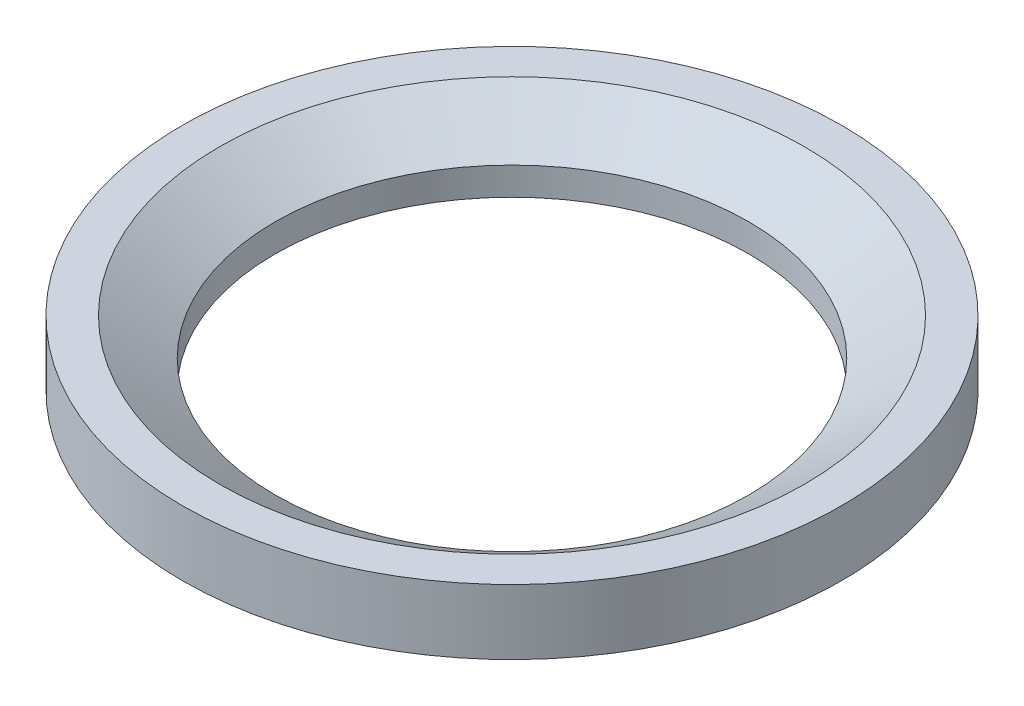
from build123d import *

# Parameters (mm, degrees)
SKETCH1_R           = 35.5
SKETCH1_R_2         = 25.5
BOSS_EXTRUDE1_DEPTH = 7
CHAMFER1_SIZE       = 6
CHAMFER1_SIZE2      = 4


with BuildPart() as part:
    # Sketch1 → Boss-Extrude1 (new body)
    with BuildSketch(Plane(origin=(0, 0, 0), x_dir=(1, 0, 0), z_dir=(0, 1, 0))):
        with Locations(Location((0, 0, 0), (0, 0, 270))):
            Circle(SKETCH1_R)
        with Locations(Location((0, 0, 0), (0, 0, 270))):
            Circle(SKETCH1_R_2, mode=Mode.SUBTRACT)
    extrude(amount=BOSS_EXTRUDE1_DEPTH)

    # Chamfer1
    chamfer1_edges = [part.edges().sort_by_distance(p)[0] for p in [
        (0, 7, -25.5),
    ]]
    chamfer1_side = [part.faces().sort_by_distance(p)[0] for p in [
        (0, 7, -34.495908371),
    ]]
    chamfer(chamfer1_edges, length=CHAMFER1_SIZE, length2=CHAMFER1_SIZE2, reference=chamfer1_side[0])


solid = part.part
